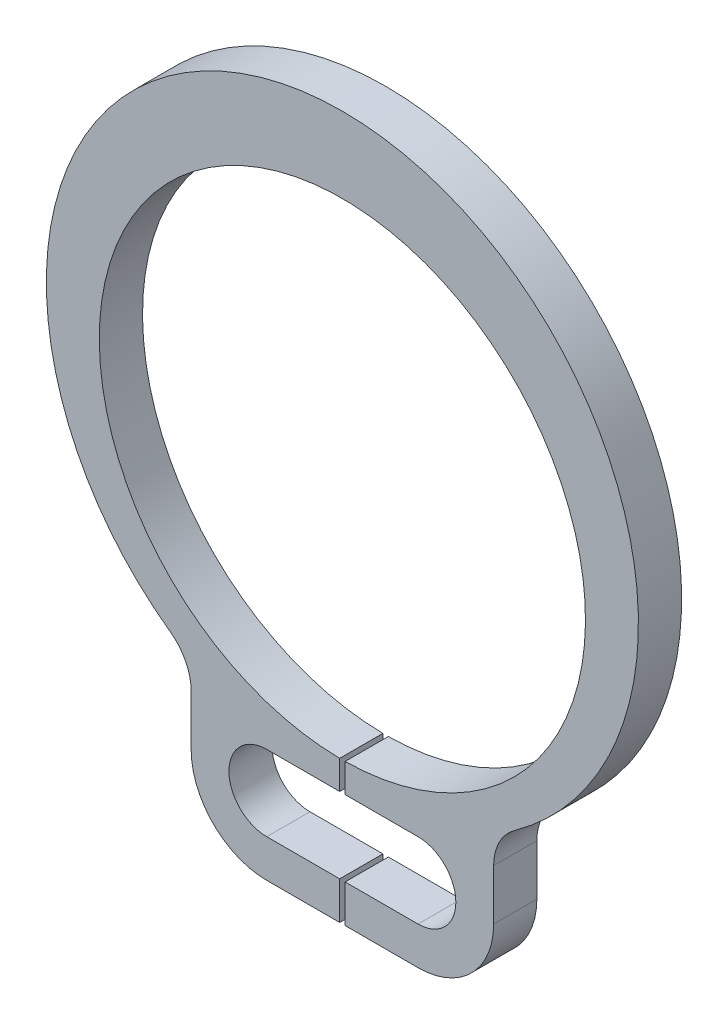
from build123d import *

# Parameters (mm, degrees)
SKETCH_1_R          = 2.25
SKETCH_1_R_2        = 0.35
EXTRUDE_1_DEPTH     = 0.4
SKETCH_2_W          = 0.05
SKETCH_2_H          = 3.565745976
CUT_EXTRUDE_1_DEPTH = 5.514658832
FILLET_1_R          = 0.466666667
CUT_EXTRUDE_2_DEPTH = 5.514658832


with BuildPart() as part:
    # 草图1 → 凸台-拉伸1 (new body)
    with BuildSketch(Plane.XY):
        with BuildLine():
            Line((-0.7, -3.565745976), (0.7, -3.565745976))
            ThreePointArc((0.7, -3.565745976), (1.194974747, -3.360720723), (1.4, -2.865745976))
            Line((1.4, -2.865745976), (1.4, -2.145334371))
            ThreePointArc((1.4, -2.145334371), (0, 2.95), (-1.4, -2.145334371))
            Line((-1.4, -2.145334371), (-1.4, -2.865745976))
            ThreePointArc((-1.4, -2.865745976), (-1.194974747, -3.360720723), (-0.7, -3.565745976))
        make_face()
        Circle(SKETCH_1_R, mode=Mode.SUBTRACT)
        with Locations((-0.7, -2.865745976)):
            Circle(SKETCH_1_R_2, mode=Mode.SUBTRACT)
        with Locations(Location((0.7, -2.865745976, 0), (0, 0, 180))):
            Circle(SKETCH_1_R_2, mode=Mode.SUBTRACT)
    extrude(amount=EXTRUDE_1_DEPTH)

    # 草图2 → 切除-拉伸1 (cut, through all)
    with BuildSketch(Plane.XY.offset(0.4)):
        with Locations((0, -1.782872988)):
            Rectangle(SKETCH_2_W, SKETCH_2_H)
    extrude(amount=-CUT_EXTRUDE_1_DEPTH, mode=Mode.SUBTRACT)

    # 圆角1
    fillet_1_edges = [part.edges().sort_by_distance(p)[0] for p in [
        (-1.4, -2.145334371, 0.2),
        (1.4, -2.145334371, 0.2),
    ]]
    fillet(fillet_1_edges, radius=FILLET_1_R)

    # 草图3 → 切除-拉伸2 (cut, through all)
    with BuildSketch(Plane.XY.offset(0.4)):
        with BuildLine():
            Line((-0.7, -2.515745976), (0.7, -2.515745976))
            ThreePointArc((0.7, -2.515745976), (1.05, -2.865745976), (0.7, -3.215745976))
            Line((0.7, -3.215745976), (-0.7, -3.215745976))
            ThreePointArc((-0.7, -3.215745976), (-1.05, -2.865745976), (-0.7, -2.515745976))
        make_face()
    extrude(amount=-CUT_EXTRUDE_2_DEPTH, mode=Mode.SUBTRACT)


solid = part.part
